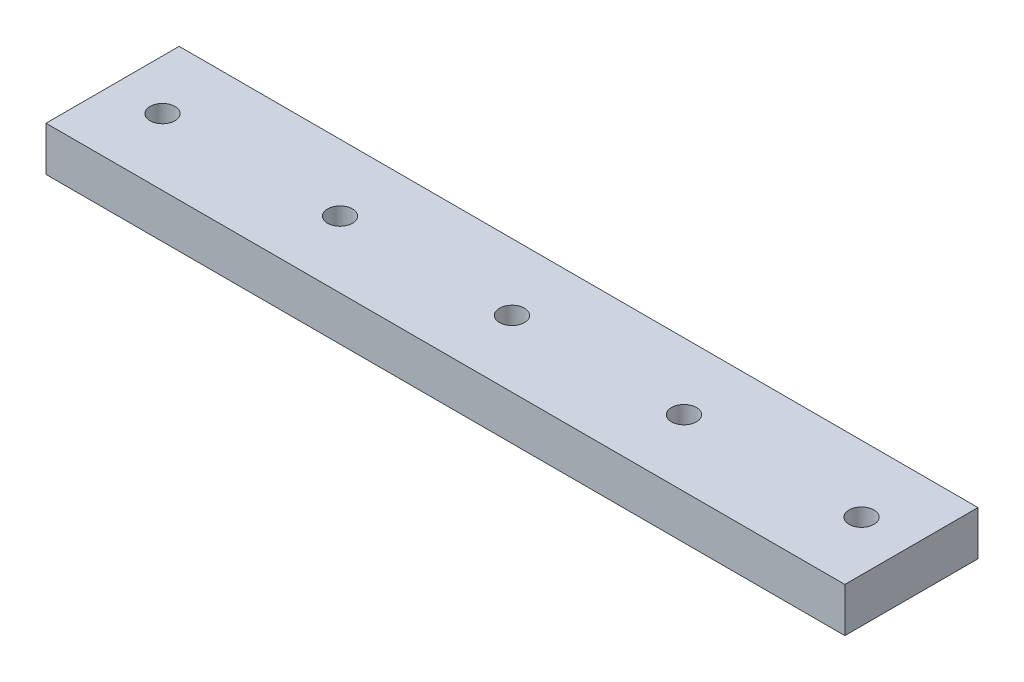
from build123d import *

# Parameters (mm, degrees)
SKETCH1_W           = 228.6
SKETCH1_H           = 38.1
SKETCH1_R           = 3.571875
BOSS_EXTRUDE1_DEPTH = 12.7


with BuildPart() as part:
    # Sketch1 → Boss-Extrude1 (new body)
    with BuildSketch(Plane(origin=(0, 0, 0), x_dir=(1, 0, 0), z_dir=(0, 1, 0))):
        with Locations((114.3, -19.05)):
            Rectangle(SKETCH1_W, SKETCH1_H)
        with Locations(Location((14.2875, -19.05, 0), (0, 0, 270))):
            Circle(SKETCH1_R, mode=Mode.SUBTRACT)
        with Locations(Location((65.0875, -19.05, 0), (0, 0, 270))):
            Circle(SKETCH1_R, mode=Mode.SUBTRACT)
        with Locations(Location((114.3, -19.05, 0), (0, 0, 270))):
            Circle(SKETCH1_R, mode=Mode.SUBTRACT)
        with Locations(Location((163.5125, -19.05, 0), (0, 0, 270))):
            Circle(SKETCH1_R, mode=Mode.SUBTRACT)
        with Locations(Location((214.3125, -19.05, 0), (0, 0, 270))):
            Circle(SKETCH1_R, mode=Mode.SUBTRACT)
    extrude(amount=BOSS_EXTRUDE1_DEPTH)


solid = part.part
